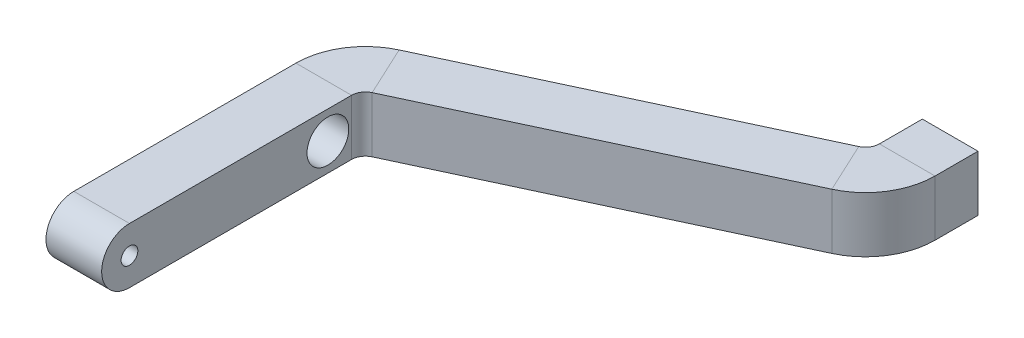
from build123d import *

# Parameters (mm, degrees)
SKETCH_2_W          = 40
SKETCH_2_H          = 40
FILLET_1_RADIUS     = 20
FILLET_1_LENGTH     = 40
SKETCH_3_R          = 6
CUT_EXTRUDE_1_DEPTH = 477.759897642
SKETCH_4_R          = 10
CUT_EXTRUDE_2_DEPTH = 10
SKETCH_5_R          = 15
CUT_EXTRUDE_3_DEPTH = 477.759897642


with BuildPart() as part:
    # 扫描1: sweep along a path in 草图1
    with BuildLine(Plane(origin=(0, 0, 0), x_dir=(1, 0, 0), z_dir=(0, 1, 0))) as sweep_1_path:
        Line((0, 0), (0, -30.887892176))
        ThreePointArc((0, -30.887892176), (-4.698256626, -47.006880426), (-17.321452148, -58.077125787))
        Line((-17.321452148, -58.077125787), (-242.678547852, -163.162865333))
        ThreePointArc((-242.678547852, -163.162865333), (-255.301743374, -174.233110694), (-260, -190.352098945))
        Line((-260, -190.352098945), (-260, -370))
    # 草图2 → 扫描1 (sweep)
    with BuildSketch(Plane.XY):
        Rectangle(SKETCH_2_W, SKETCH_2_H)
    sweep(path=sweep_1_path.line)

    # 圆角1: full round fillet: the end face becomes a half cylinder, R = half its width
    fillet_1_face = Plane((-260, 0, 370), x_dir=(1, 0, 0), z_dir=(0, 0, 1))  # on the end face: x along it, z out of the body
    fillet_1_slab = fillet_1_face.offset(-FILLET_1_RADIUS / 2) * Box(FILLET_1_LENGTH, 2 * FILLET_1_RADIUS, FILLET_1_RADIUS, mode=Mode.PRIVATE)  # the body's end, R deep
    fillet_1_round = Plane((-260, 0, 350), x_dir=(0, 0, 1), z_dir=(1, 0, 0)) * Cylinder(FILLET_1_RADIUS, FILLET_1_LENGTH, mode=Mode.PRIVATE)  # its axis R under the face
    add(fillet_1_slab - fillet_1_round, mode=Mode.SUBTRACT)

    # 草图3 → 切除-拉伸1 (cut, through all)
    with BuildSketch(Plane.ZY.offset(280)):
        with Locations((350, 0)):
            Circle(SKETCH_3_R)
    extrude(amount=-CUT_EXTRUDE_1_DEPTH, mode=Mode.SUBTRACT)

    # 草图4 → 切除-拉伸2 (cut)
    with BuildSketch(Plane(origin=(0, 0, 0), x_dir=(-1, 0, 0), z_dir=(0, 0, -1))):
        Circle(SKETCH_4_R)
    extrude(amount=-CUT_EXTRUDE_2_DEPTH, mode=Mode.SUBTRACT)

    # 草图5 → 切除-拉伸3 (cut, through all)
    with BuildSketch(Plane.ZY.offset(280)):
        with Locations((207.352098945, 0)):
            Circle(SKETCH_5_R)
    extrude(amount=-CUT_EXTRUDE_3_DEPTH, mode=Mode.SUBTRACT)


solid = part.part
